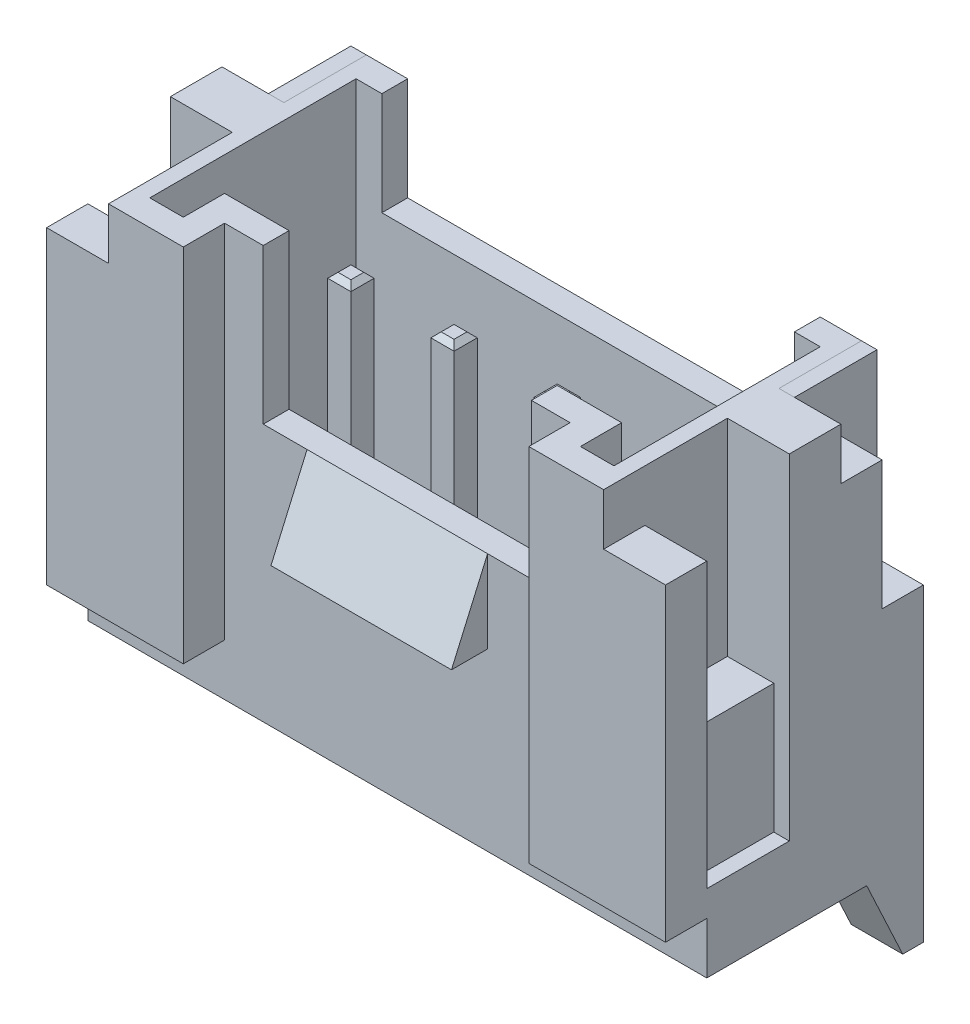
from build123d import *

# Parameters (mm, degrees)
BOSS_EXTRU_1_DEPTH                       = 6
BOSS_EXTRU_2_START                       = 5
BOSS_EXTRU_2_DEPTH                       = 1
ESQUISSE3_W                              = 6.7
ESQUISSE3_H                              = 1.6
ENL_V_MAT_EXTRU_1_DEPTH                  = 13.298373876
ENL_V_MAT_EXTRU_2_DEPTH                  = 6.5
ENL_V_MAT_EXTRU_4_DEPTH                  = 1.2
ESQUISSE8_W                              = 1.6
ESQUISSE8_H                              = 2.5
ENL_V_MAT_EXTRU_5_DEPTH                  = 0.3
ESQUISSE9_W                              = 5.6
ESQUISSE9_H                              = 2
ENL_V_MAT_EXTRU_6_DEPTH                  = 13.103718437
ENL_V_MAT_EXTRU_7_REACH                  = 13.995
ESQUISSE10_W                             = 5.2
ESQUISSE10_H                             = 6
BOSS_EXTRU_3_DEPTH                       = 1.75
ESQUISSE5_W                              = 8
ESQUISSE5_H                              = 1
ENL_V_MAT_EXTRU_3_DEPTH                  = 2
EXTRU_MINCE1_START                       = 3
EXTRU_MINCE1_DEPTH                       = 0.225
CHANFREIN1_SIZE                          = 0.1
CHANFREIN2_SIZE                          = 0.6
CHANFREIN2_SIZE2                         = 0.3
R_P_TITION_LIN_AIRE1_COUNT               = 4
R_P_TITION_LIN_AIRE1_PITCH               = 2
CHANFREIN1_OF_R_P_TITION_LIN_AIRE1_SIZE  = 0.1
CHANFREIN2_OF_R_P_TITION_LIN_AIRE1_SIZE2 = 0.6
CHANFREIN2_OF_R_P_TITION_LIN_AIRE1_SIZE  = 0.3
BOSS_EXTRU_4_DEPTH                       = 0.3
BOSS_EXTRU_5_DEPTH                       = 0.3


with BuildPart() as part:
    # Esquisse1 → Boss.-Extru.1 (new, symmetric)
    with BuildSketch(Plane(origin=(0, 0, 0), x_dir=(0, 0, -1), z_dir=(1, 0, 0))):
        Polygon((0, 0), (-5, 0), (-5, -7), (-4.2, -7), (-4.2, -8), (0, -8), align=None)
    extrude(amount=BOSS_EXTRU_1_DEPTH, both=True)

    # Esquisse2 → Boss.-Extru.2 (add)
    with BuildSketch(Plane(origin=(0, 0, 0), x_dir=(0, 0, -1), z_dir=(1, 0, 0)).offset(BOSS_EXTRU_2_START)):
        Polygon((0, -8), (0, -9.5), (-0.4, -9.5), (-1.099461487, -8), align=None)
    boss_extru_2 = extrude(amount=BOSS_EXTRU_2_DEPTH)

    # Esquisse3 → Enlèv. mat.-Extru.1 (cut, through all)
    with BuildSketch(Plane(origin=(0, 0, 0), x_dir=(1, 0, 0), z_dir=(0, 1, 0))):
        with Locations((0, -5)):
            Rectangle(ESQUISSE3_W, ESQUISSE3_H)
    extrude(amount=-ENL_V_MAT_EXTRU_1_DEPTH, mode=Mode.SUBTRACT)

    # Esquisse4 → Enlèv. mat.-Extru.2 (cut)
    with BuildSketch(Plane(origin=(0, 0, 0), x_dir=(1, 0, 0), z_dir=(0, 1, 0))):
        Polygon((-4.5, -4.5), (-3.85, -4.5), (-3.85, -3.7), (3.85, -3.7), (3.85, -4.5), (4.5, -4.5), (4.5, -0.5), (-4.5, -0.5), align=None)
    extrude(amount=-ENL_V_MAT_EXTRU_2_DEPTH, mode=Mode.SUBTRACT)

    # Esquisse7 → Enlèv. mat.-Extru.4 (cut)
    with BuildSketch(Plane(origin=(6, 0, 0), x_dir=(0, 0, -1), z_dir=(1, 0, 0))):
        Polygon((-5, -1), (-4.2, -1), (-4.2, -4), (-2.6, -4), (-2.6, 0), (-5, 0), align=None)
        Polygon((0, 0), (-1.6, 0), (-1.6, -1), (-0.8, -1), (-0.8, -3.5), (0, -3.5), align=None)
    enl_v_mat_extru_4 = extrude(amount=-ENL_V_MAT_EXTRU_4_DEPTH, mode=Mode.SUBTRACT)

    # Esquisse8 → Enlèv. mat.-Extru.5 (cut)
    with BuildSketch(Plane(origin=(6, 0, 0), x_dir=(0, 0, -1), z_dir=(1, 0, 0))):
        with Locations((-3.4, -5.25)):
            Rectangle(ESQUISSE8_W, ESQUISSE8_H)
    enl_v_mat_extru_5 = extrude(amount=-ENL_V_MAT_EXTRU_5_DEPTH, mode=Mode.SUBTRACT)

    # Esquisse9 → Enlèv. mat.-Extru.6 (cut, through all)
    with BuildSketch(Plane.XY.offset(0.5)):
        Rectangle(ESQUISSE9_W, ESQUISSE9_H)
    extrude(amount=-ENL_V_MAT_EXTRU_6_DEPTH, mode=Mode.SUBTRACT)

    # Esquisse10 → Enlèv. mat.-Extru.7 (cut, up to next)
    with BuildSketch(Plane.XY.offset(4.2), mode=Mode.PRIVATE) as enl_v_mat_extru_7_sk1:
        Rectangle(ESQUISSE10_W, ESQUISSE10_H)
    enl_v_mat_extru_7_tool1 = extrude(enl_v_mat_extru_7_sk1.sketch, amount=-ENL_V_MAT_EXTRU_7_REACH, mode=Mode.PRIVATE) & part.part
    add(enl_v_mat_extru_7_tool1.solids().sort_by_distance((0, 0, 4.2))[0], mode=Mode.SUBTRACT)

    # Esquisse12 → Boss.-Extru.3 (add, symmetric)
    with BuildSketch(Plane(origin=(0, 0, 0), x_dir=(0, 0, -1), z_dir=(1, 0, 0))):
        Polygon((-4.2, -3), (-4.9, -4.6), (-4.2, -4.6), align=None)
    extrude(amount=BOSS_EXTRU_3_DEPTH, both=True)

    # Esquisse5 → Enlèv. mat.-Extru.3 (cut)
    with BuildSketch(Plane(origin=(0, 0, 0), x_dir=(1, 0, 0), z_dir=(0, 1, 0))):
        Rectangle(ESQUISSE5_W, ESQUISSE5_H)
    extrude(amount=-ENL_V_MAT_EXTRU_3_DEPTH, mode=Mode.SUBTRACT)


with BuildPart() as body_2:
    # Esquisse13 → Extru.-Mince1 (new, symmetric)
    with BuildSketch(Plane(origin=(0, 0, 0), x_dir=(0, 0, -1), z_dir=(1, 0, 0)).offset(EXTRU_MINCE1_START)):
        with BuildLine():
            Line((-2.325, -1.7), (-2.325, -8))
            ThreePointArc((-2.325, -8), (-2.185875721, -8.335875721), (-1.85, -8.475))
            Line((-1.85, -8.475), (-0.5, -8.475))
            ThreePointArc((-0.5, -8.475), (-0.48232233, -8.48232233), (-0.475, -8.5))
            Line((-0.475, -8.5), (-0.475, -10))
            Line((-0.475, -10), (-0.025, -10))
            Line((-0.025, -10), (-0.025, -8.5))
            ThreePointArc((-0.025, -8.5), (-0.164124279, -8.164124279), (-0.5, -8.025))
            Line((-0.5, -8.025), (-1.85, -8.025))
            ThreePointArc((-1.85, -8.025), (-1.86767767, -8.01767767), (-1.875, -8))
            Line((-1.875, -8), (-1.875, -1.7))
            Line((-1.875, -1.7), (-2.325, -1.7))
        make_face()
    extru_mince1 = extrude(amount=EXTRU_MINCE1_DEPTH, both=True)

    # Chanfrein1
    chanfrein1_edges = [body_2.edges().sort_by_distance(p)[0] for p in [
        (2.775, -1.7, 2.1),
        (3, -1.7, 2.325),
        (3, -1.7, 1.875),
        (3.225, -1.7, 2.1),
    ]]
    chamfer(chanfrein1_edges, length=CHANFREIN1_SIZE)

    # Chanfrein2
    chanfrein2_edges = [body_2.edges().sort_by_distance(p)[0] for p in [
        (3, -10, 0.475),
    ]]
    chanfrein2_side = [body_2.faces().sort_by_distance(p)[0] for p in [
        (3, -9.25, 0.475),
    ]]
    chamfer(chanfrein2_edges, length=CHANFREIN2_SIZE, length2=CHANFREIN2_SIZE2, reference=chanfrein2_side[0])


with BuildPart() as part_1:
    add(part.part)

    # Répétition linéaire1: Extru.-Mince1 ×4
    with Locations(*[(-i * R_P_TITION_LIN_AIRE1_PITCH, 0, 0) for i in range(1, R_P_TITION_LIN_AIRE1_COUNT)]):
        add(extru_mince1)

    # Chanfrein1 of Répétition linéaire1
    chanfrein1_of_r_p_tition_lin_aire1_edges = [part_1.edges().sort_by_distance(p)[0] for p in [
        (0.775, -1.7, 2.1),
        (1, -1.7, 2.325),
        (1, -1.7, 1.875),
        (1.225, -1.7, 2.1),
        (-1.225, -1.7, 2.1),
        (-1, -1.7, 2.325),
        (-1, -1.7, 1.875),
        (-0.775, -1.7, 2.1),
        (-3.225, -1.7, 2.1),
        (-3, -1.7, 2.325),
        (-3, -1.7, 1.875),
        (-2.775, -1.7, 2.1),
    ]]
    chamfer(chanfrein1_of_r_p_tition_lin_aire1_edges, length=CHANFREIN1_OF_R_P_TITION_LIN_AIRE1_SIZE)

    # Chanfrein2 of Répétition linéaire1
    chanfrein2_of_r_p_tition_lin_aire1_edges = [part_1.edges().sort_by_distance(p)[0] for p in [
        (1, -10, 0.475),
        (-1, -10, 0.475),
        (-3, -10, 0.475),
    ]]
    chamfer(chanfrein2_of_r_p_tition_lin_aire1_edges, length=CHANFREIN2_OF_R_P_TITION_LIN_AIRE1_SIZE, length2=CHANFREIN2_OF_R_P_TITION_LIN_AIRE1_SIZE2)

    # Symétrie2: Boss.-Extru.2, Enlèv. mat.-Extru.4, Enlèv. mat.-Extru.5 across plane
    add(boss_extru_2.mirror(Plane(origin=(0, 0, 0), x_dir=(0, 0, 1), z_dir=(1, 0, 0))))
    add(enl_v_mat_extru_4.mirror(Plane(origin=(0, 0, 0), x_dir=(0, 0, 1), z_dir=(1, 0, 0))), mode=Mode.SUBTRACT)
    add(enl_v_mat_extru_5.mirror(Plane(origin=(0, 0, 0), x_dir=(0, 0, 1), z_dir=(1, 0, 0))), mode=Mode.SUBTRACT)


with BuildPart() as body_3:
    # Esquisse14 → Boss.-Extru.4 (new body)
    with BuildSketch(Plane(origin=(4.8, 0, 0), x_dir=(0, 0, -1), z_dir=(1, 0, 0))):
        Polygon((0, -3.5), (0, 0), (-1.6, 0), (-1.6, -1), (-0.8, -1), (-0.8, -3.5), align=None)
    extrude(amount=BOSS_EXTRU_4_DEPTH)


with BuildPart() as body_4:
    # Esquisse15 → Boss.-Extru.5 (new body)
    with BuildSketch(Plane.ZY.offset(4.8)):
        Polygon((0, 0), (0, -3.5), (0.8, -3.5), (0.8, -1), (1.6, -1), (1.6, 0), align=None)
    extrude(amount=BOSS_EXTRU_5_DEPTH)


solid = Compound([body_2.part, part_1.part, body_3.part, body_4.part])
